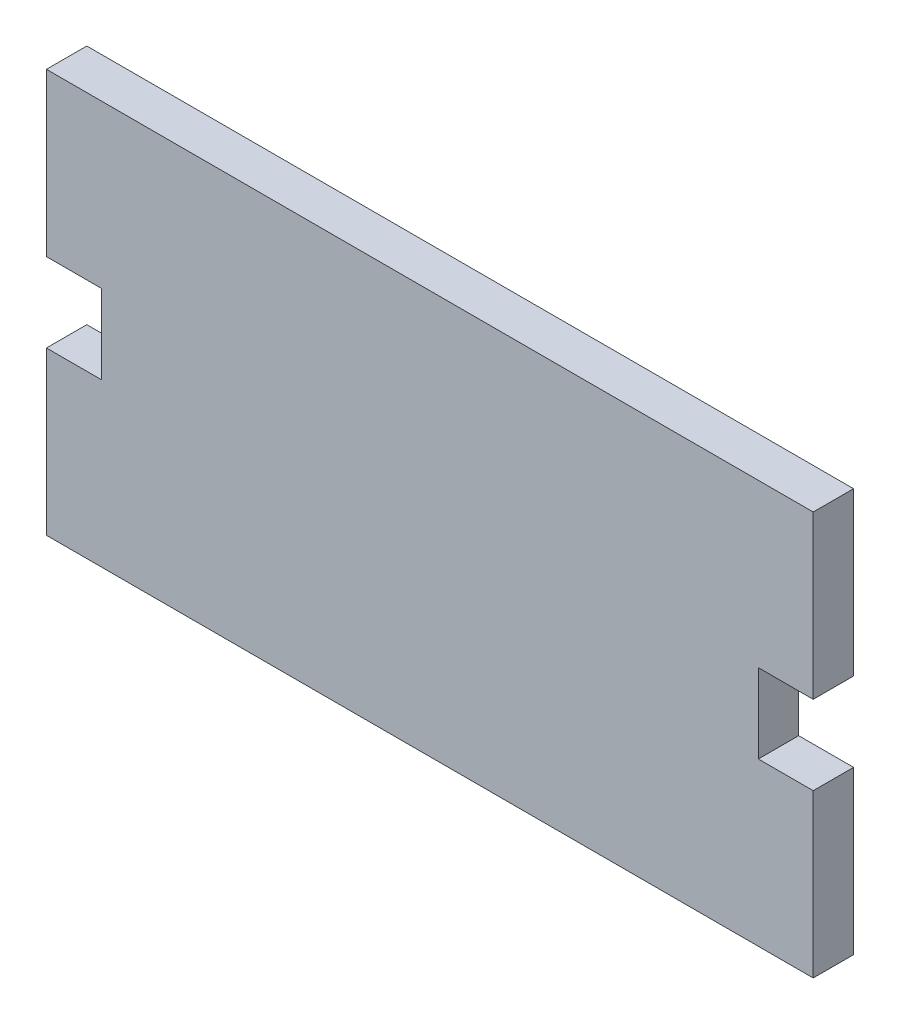
from build123d import *

# Parameters (mm, degrees)
SKETCH1_W           = 120.65
SKETCH1_H           = 63.5
BOSS_EXTRUDE1_DEPTH = 6.35
SKETCH2_W           = 8.636
SKETCH2_H           = 12.446
CUT_EXTRUDE1_DEPTH  = 6.35


with BuildPart() as part:
    # Sketch1 → Boss-Extrude1 (new body)
    with BuildSketch(Plane.XY):
        with Locations((60.325, 31.75)):
            Rectangle(SKETCH1_W, SKETCH1_H)
    extrude(amount=BOSS_EXTRUDE1_DEPTH)

    # Sketch2 → Cut-Extrude1 (cut)
    with BuildSketch(Plane.XY.offset(6.35)):
        with Locations((4.318, 31.75)):
            Rectangle(SKETCH2_W, SKETCH2_H)
        with Locations((116.332, 31.75)):
            Rectangle(SKETCH2_W, SKETCH2_H)
    extrude(amount=-CUT_EXTRUDE1_DEPTH, mode=Mode.SUBTRACT)


solid = part.part
